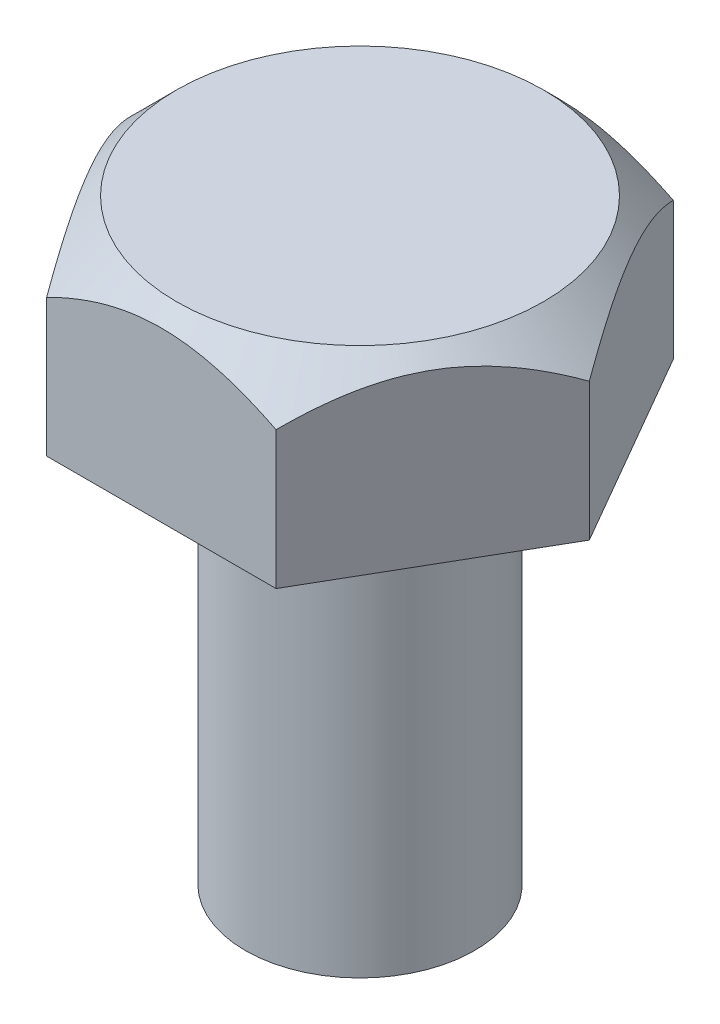
from build123d import *

# Parameters (mm, degrees)
SKETCH1_R           = 2.5
BOSS_EXTRUDE1_DEPTH = 9
BOSS_EXTRUDE2_DEPTH = 4


with BuildPart() as part:
    # Sketch1 → Boss-Extrude1 (new body)
    with BuildSketch(Plane(origin=(0, 0, 0), x_dir=(1, 0, 0), z_dir=(0, 1, 0))):
        with Locations(Location((0, 0, 0), (0, 0, 270))):
            Circle(SKETCH1_R)
    extrude(amount=BOSS_EXTRUDE1_DEPTH)

    # Sketch2 → Boss-Extrude2 (add)
    with BuildSketch(Plane(origin=(0, 9, 0), x_dir=(1, 0, 0), z_dir=(0, 1, 0))):
        Polygon((-2.5, -4.330127019), (2.5, -4.330127019), (5, 0), (2.5, 4.330127019), (-2.5, 4.330127019), (-5, 0), align=None)
    extrude(amount=BOSS_EXTRUDE2_DEPTH)

    # Sketch3 → Cut-Revolve1 (revolve, cut)
    with BuildSketch(Plane.XY, mode=Mode.PRIVATE) as cut_revolve1_sk:
        Polygon((4, 13), (5, 12), (5, 13), align=None)
    revolve(cut_revolve1_sk.sketch.rotate(Axis((0, 9, 0), (0, 1, 0)), 90), axis=Axis((0, 9, 0), (0, 1, 0)), mode=Mode.SUBTRACT)


solid = part.part
